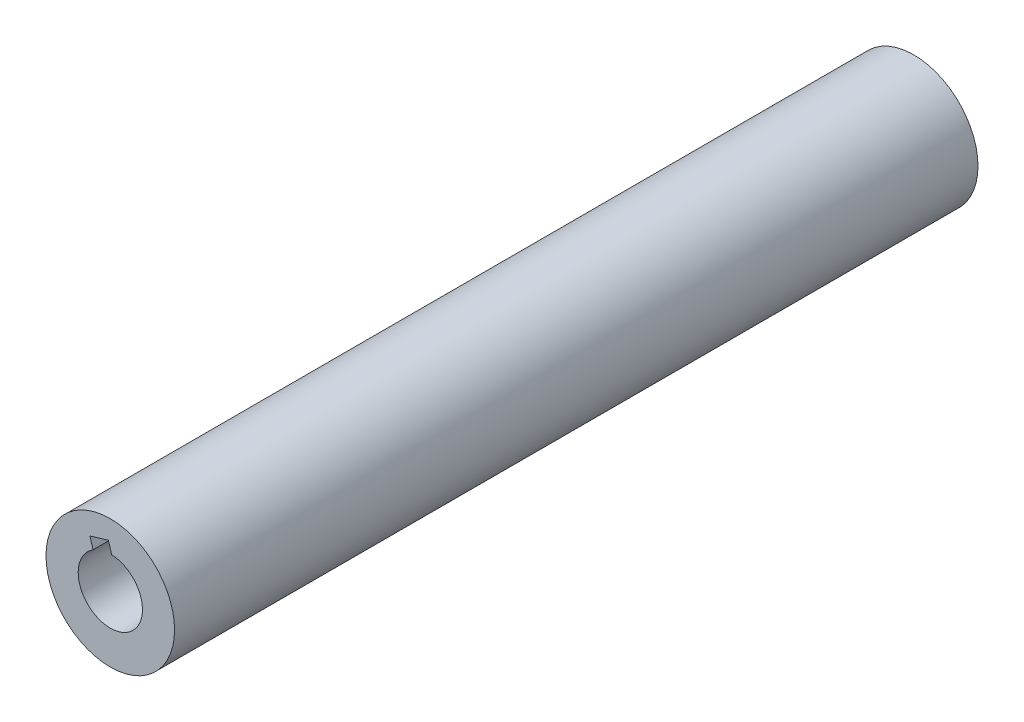
from build123d import *

# Parameters (mm, degrees)
EXTRUDE_START            = -275
SKETCH_1_R               = 20
SKETCH_1_R_2             = 10
EXTRUDE_1_DEPTH          = 250
CUT_EXTRUDE_1_REACH      = 282.584
CUT_EXTRUDE_1_END_RADIUS = 10
CUT_EXTRUDE_START        = -3
SKETCH_2_W               = 250
SKETCH_2_H               = 6


with BuildPart() as part:
    # 草圖1 → 填料-伸長1 (new body)
    with BuildSketch(Plane.XY.offset(EXTRUDE_START)):
        with Locations((-0.015741253, -0.499752152)):
            Circle(SKETCH_1_R)
        Circle(SKETCH_1_R_2, mode=Mode.SUBTRACT)
    extrude(amount=EXTRUDE_1_DEPTH)

    # 除料-伸長1: up to this cylinder (the profile starts outside it)
    cut_extrude_1_end = Plane(origin=(0, 0, -150), z_dir=(0, 0, 1)) * Cylinder(CUT_EXTRUDE_1_END_RADIUS, 586.168, mode=Mode.PRIVATE)
    # 草圖2 → 除料-伸長1 (cut, up to the surface)
    with BuildSketch(Plane(origin=(-2.893904806, 9.572111312, 0), x_dir=(0, 0, 1), z_dir=(0.28939048064098244, -0.9572111312110727, 0)).offset(CUT_EXTRUDE_START), mode=Mode.PRIVATE) as cut_extrude_1_sk1:
        with Locations((-150, -0.296650626)):
            Rectangle(SKETCH_2_W, SKETCH_2_H)
    cut_extrude_1_tool1 = extrude(cut_extrude_1_sk1.sketch, amount=CUT_EXTRUDE_1_REACH, mode=Mode.PRIVATE) - cut_extrude_1_end
    add(cut_extrude_1_tool1.solids().sort_by_distance((-3.478119, 12.529593, -150))[0], mode=Mode.SUBTRACT)


solid = part.part
